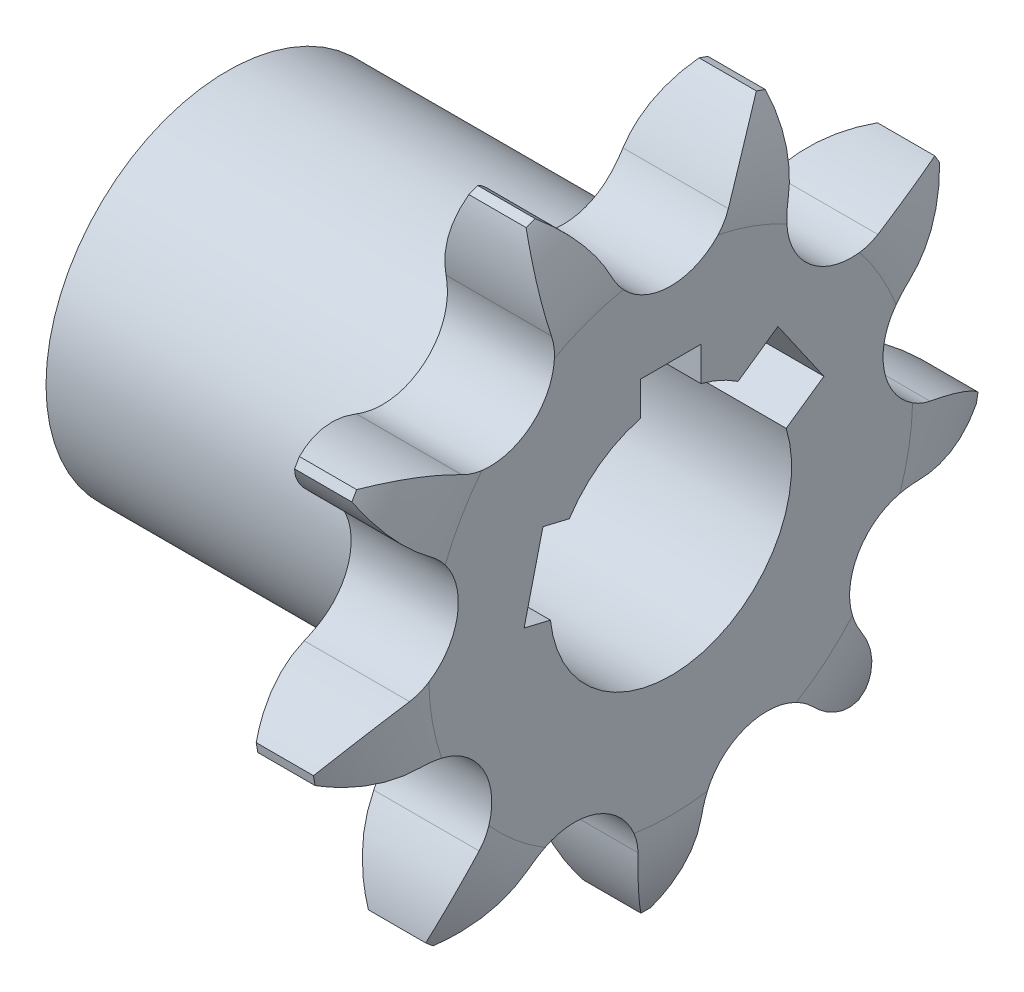
from build123d import *

# Parameters (mm, degrees)
TOOTHCUT_DEPTH      = 25.212835916
TEETHCUTS_COUNT     = 9
TEETHCUTS_ANGLE     = 320
HUBNEAONESKE_R      = 8.409661226
HUBNEARONE_DEPTH    = 16.6809
HUBNEARONEFILLET_R  = 0.4
BORSKE_R            = 6
BORE_DEPTH          = 22.0005
SKETCH1_W           = 3
SKETCH1_H           = 3
CUT_EXTRUDE1_DEPTH  = 33.16954481
CUT_EXTRUDE2_DEPTH  = 33.169544878
BOSS_EXTRUDE1_REACH = 34.17
SKETCH3_R           = 9
SKETCH3_R_2         = 8.409661226


with BuildPart() as part:
    # BasProSke → Base-Revolve (revolve)
    with BuildSketch(Plane(origin=(0, 0, 0), x_dir=(1, 0, 0), z_dir=(0, 1, 0)), mode=Mode.PRIVATE) as base_revolve_sk:
        with BuildLine():
            Line((0, 0), (0, 12.006866982))
            ThreePointArc((0, 12.006866982), (0.314698702, 14.435029868), (1.238, 16.702743471))
            Line((1.238, 16.702743471), (4.0816, 16.702743471))
            ThreePointArc((4.0816, 16.702743471), (5.004901298, 14.435029868), (5.3196, 12.006866982))
            Line((5.3196, 12.006866982), (5.3196, 0))
            Line((5.3196, 0), (0, 0))
        make_face()
    revolve(base_revolve_sk.sketch.rotate(Axis((-10, 0, 0), (1, 0, 0)), 180), axis=Axis((-10, 0, 0), (1, 0, 0)))

    # TooCutSke → ToothCut (cut, through all)
    with BuildSketch(Plane(origin=(0, 0, 0), x_dir=(0, 0, -1), z_dir=(1, 0, 0))):
        with BuildLine():
            ThreePointArc((2.906302496, 12.60113736), (4.198990076, 14.583034398), (5.994051414, 16.124693193))
            ThreePointArc((5.994051414, 16.124693193), (0, 17.202743471), (-5.994051414, 16.124693193))
            ThreePointArc((-5.994051414, 16.124693193), (-4.198990076, 14.583034398), (-2.906302496, 12.60113736))
            ThreePointArc((-2.906302496, 12.60113736), (0, 10.749618471), (2.906302496, 12.60113736))
        make_face()
    toothcut = extrude(amount=TOOTHCUT_DEPTH, mode=Mode.SUBTRACT)

    # TeethCuts: ToothCut ×9 about axis
    teethcuts_axis = Axis((-10, 0, 0), (1, 0, 0))
    for i in range(1, TEETHCUTS_COUNT):
        add(toothcut.rotate(teethcuts_axis, i * TEETHCUTS_ANGLE / (TEETHCUTS_COUNT - 1)), mode=Mode.SUBTRACT)

    # HubNeaOneSke → HubNearOne (add)
    with BuildSketch(Plane.ZY):
        with Locations(Location((0, 0, 0), (0, 0, 180))):
            Circle(HUBNEAONESKE_R)
    extrude(amount=HUBNEARONE_DEPTH)

    # HubNearOneFillet
    hubnearonefillet_edges = [part.edges().sort_by_distance(p)[0] for p in [
        (0, 0, 8.409661226),
    ]]
    fillet(hubnearonefillet_edges, radius=HUBNEARONEFILLET_R)

    # BorSke → Bore (cut, symmetric)
    with BuildSketch(Plane(origin=(0, 0, 0), x_dir=(0, 0, -1), z_dir=(1, 0, 0))):
        with Locations(Location((0, 0, 0), (0, 0, 180))):
            Circle(BORSKE_R)
    extrude(amount=BORE_DEPTH, both=True, mode=Mode.SUBTRACT)

    # Sketch1 → Cut-Extrude1 (cut, through all)
    with BuildSketch(Plane(origin=(5.3196, 0, 0), x_dir=(0, 0, -1), z_dir=(1, 0, 0))):
        with Locations((0, 6)):
            Rectangle(SKETCH1_W, SKETCH1_H)
        Polygon((-6.338317581, 3.58130287), (-2.449198425, 2.646020989), (-3.384480307, -1.243098166), (-7.273599462, -0.307816285), align=None)
    extrude(amount=-CUT_EXTRUDE1_DEPTH, mode=Mode.SUBTRACT)

    # Sketch2 → Cut-Extrude2 (cut, through all)
    with BuildSketch(Plane.ZY.offset(16.6809)):
        Polygon((-5.322758642, 6.355680078), (-2.037233903, 4.074161464), (-4.318752517, 0.788636724), (-7.604277256, 3.070155339), align=None)
    extrude(amount=-CUT_EXTRUDE2_DEPTH, mode=Mode.SUBTRACT)

    # Sketch3 → Boss-Extrude1 (add, up to next)
    with BuildSketch(Plane.ZY.offset(16.6809), mode=Mode.PRIVATE) as boss_extrude1_sk1:
        Circle(SKETCH3_R)
        Circle(SKETCH3_R_2, mode=Mode.SUBTRACT)
    boss_extrude1_tool1 = extrude(boss_extrude1_sk1.sketch, amount=-BOSS_EXTRUDE1_REACH, mode=Mode.PRIVATE) - part.part
    add(boss_extrude1_tool1.solids().sort_by_distance((-16.6809, 0, -8.745442))[0])


solid = part.part
